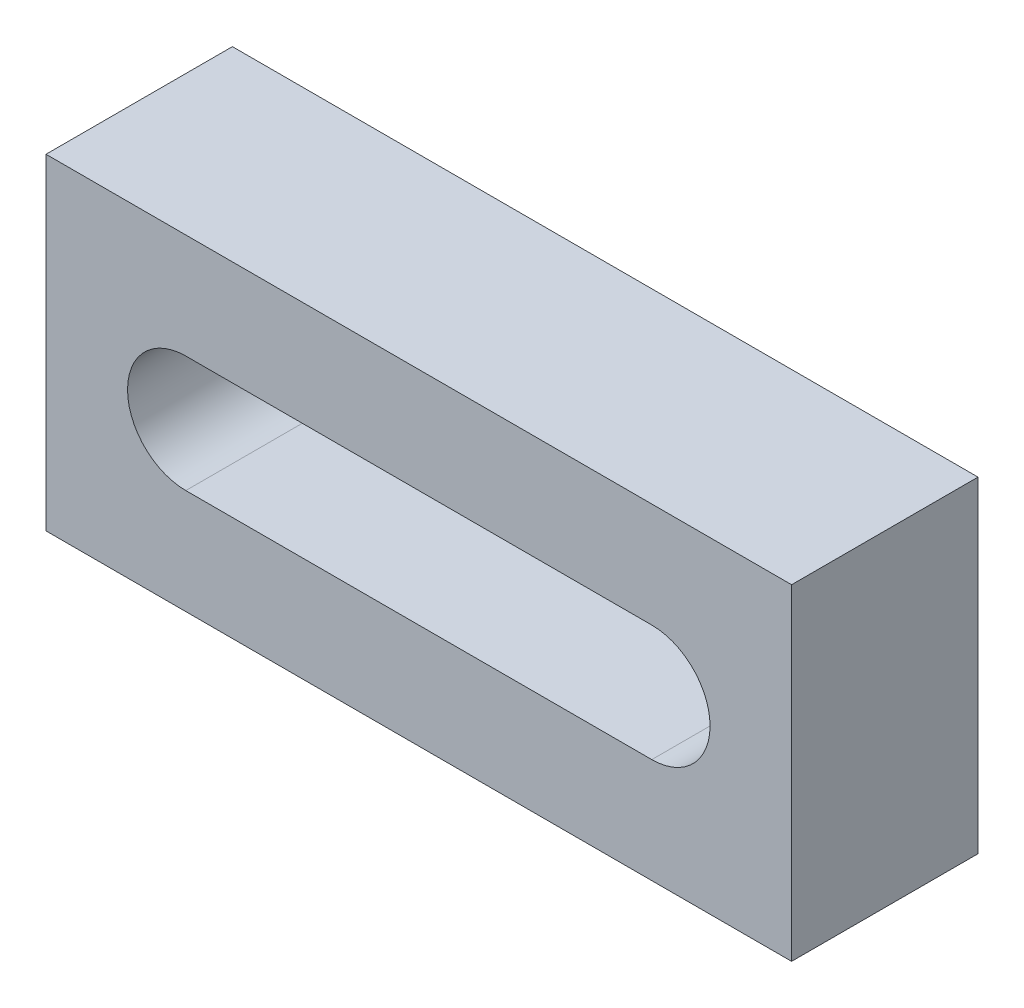
from build123d import *

# Parameters (mm, degrees)
SKETCH1_W           = 80
SKETCH1_H           = 35
BOSS_EXTRUDE1_DEPTH = 10


with BuildPart() as part:
    # Sketch1 → Boss-Extrude1 (new, symmetric)
    with BuildSketch(Plane.XY):
        Rectangle(SKETCH1_W, SKETCH1_H)
        with BuildLine():
            Line((-25, 6.25), (25, 6.25))
            ThreePointArc((25, 6.25), (31.25, 0), (25, -6.25))
            Line((25, -6.25), (-25, -6.25))
            ThreePointArc((-25, -6.25), (-31.25, 0), (-25, 6.25))
        make_face(mode=Mode.SUBTRACT)
    extrude(amount=BOSS_EXTRUDE1_DEPTH, both=True)


solid = part.part
